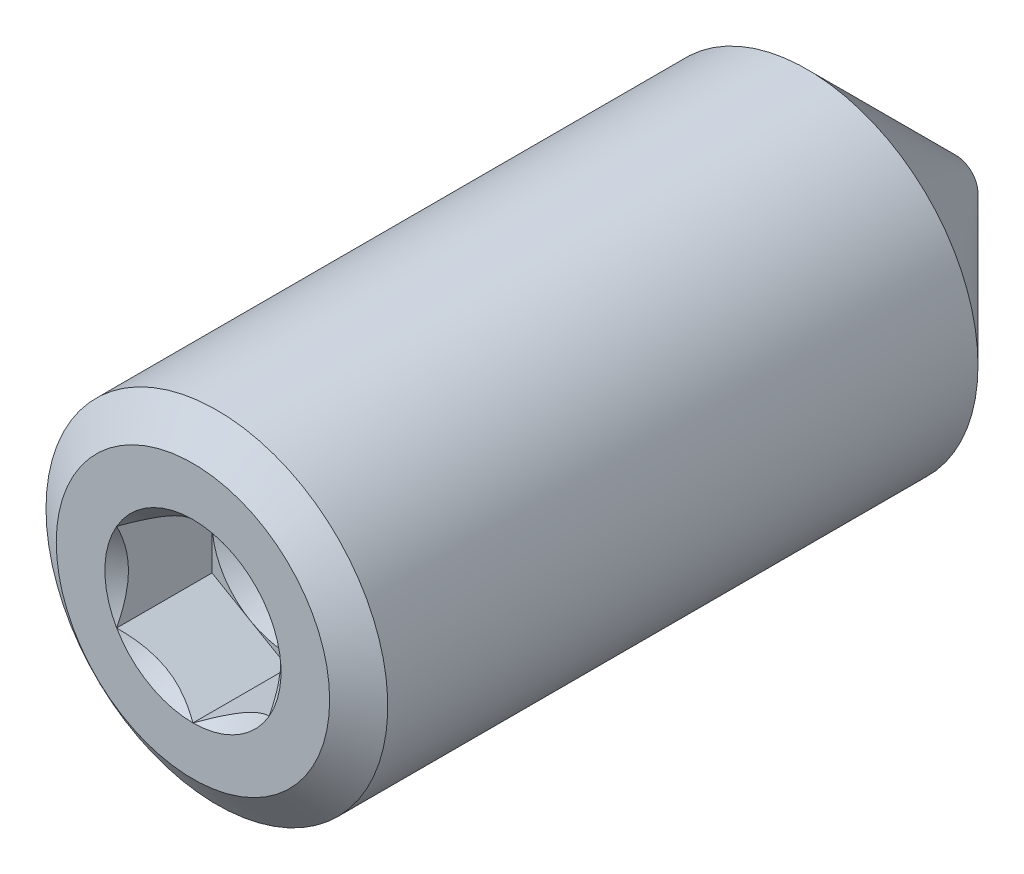
from build123d import *

# Parameters (mm, degrees)
CUT_EXTRUDE10_DEPTH = 0.79375


with BuildPart() as part:
    # Sketch22 → Revolve1 (revolve)
    with BuildSketch(Plane(origin=(0, 0, 0), x_dir=(0, 0, -1), z_dir=(1, 0, 0))):
        Polygon((-3.175, 0), (-3.175, 1.13792), (-2.97580496, 1.4224), (1.937512, 1.4224), (3.175, 0.184912), (3.175, 0), align=None)
    revolve(axis=Axis((0, 0, -3.175), (0, 0, 1)))

    # Sketch23 → Cut-Extrude10 (cut)
    with BuildSketch(Plane.XY.offset(3.175)):
        Polygon((0, 0.733234842), (-0.635, 0.366617421), (-0.635, -0.366617421), (0, -0.733234842), (0.635, -0.366617421), (0.635, 0.366617421), align=None)
    extrude(amount=-CUT_EXTRUDE10_DEPTH, mode=Mode.SUBTRACT)

    # Cut-Extrude11 cone 1 section (through the dimple's axis) → Cut-Extrude11 (revolve, cut)
    with BuildSketch(Plane(origin=(0, 0, 3.175), x_dir=(0, -1, 0), z_dir=(1, 0, 0))):
        Polygon((0, 0), (0.733234842, 0), (0, 0.733234842), align=None)
    revolve(axis=Axis((0, 0, 3.175), (0, 0, -1)), mode=Mode.SUBTRACT)

    # Cut-Extrude12 cone 1 section (through the dimple's axis) → Cut-Extrude12 (revolve, cut)
    with BuildSketch(Plane(origin=(0, 0, 2.38125), x_dir=(0, -1, 0), z_dir=(1, 0, 0))):
        Polygon((0, 0), (0.635, 0), (0, 0.366617421), align=None)
    revolve(axis=Axis((0, 0, 2.38125), (0, 0, -1)), mode=Mode.SUBTRACT)


solid = part.part
